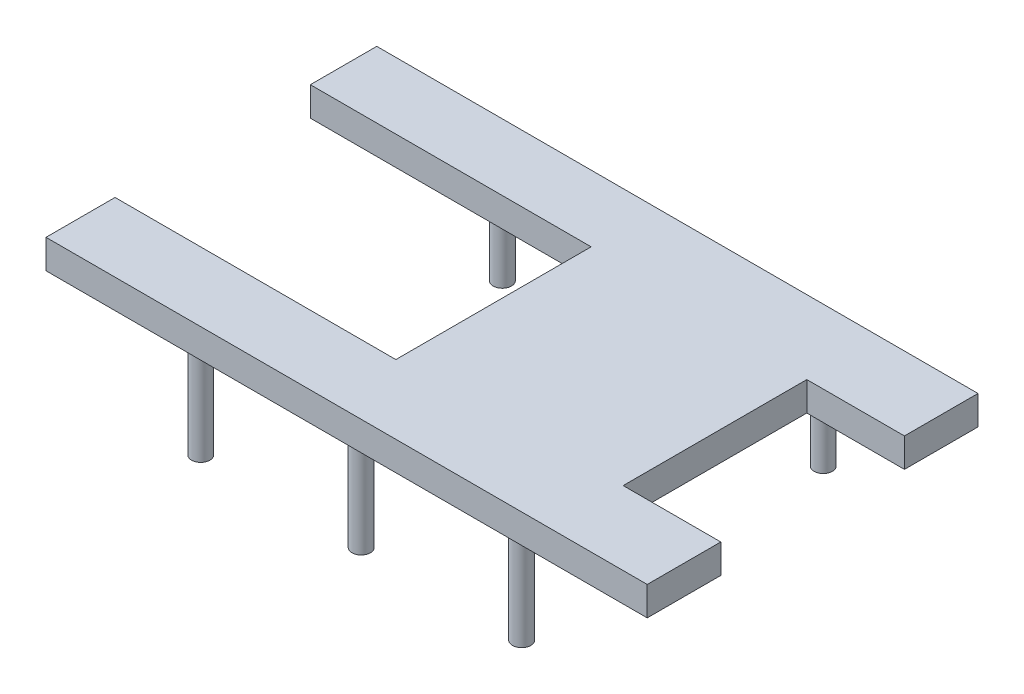
from build123d import *

# Parameters (mm, degrees)
SKETCH1_W           = 55.1
SKETCH1_H           = 27.8
BOSS_EXTRUDE1_DEPTH = 3
SKETCH3_W           = 21.65
SKETCH3_H           = 20.203759547
SKETCH3_W_2         = 17.65
SKETCH3_H_2         = 15.75
CUT_EXTRUDE1_DEPTH  = 32.00342723
SKETCH4_W           = 19.154601746
SKETCH4_H           = 20.203759547
CUT_EXTRUDE2_DEPTH  = 32.00342723
CUT_EXTRUDE3_DEPTH  = 10
SKETCH7_W           = 4.4
SKETCH7_H           = 3
BOSS_EXTRUDE2_DEPTH = 4.1
SKETCH8_W           = 3.662724417
SKETCH8_H           = 3
SKETCH8_W_2         = 3.933516036
BOSS_EXTRUDE3_DEPTH = 3
SKETCH9_W           = 62.2
SKETCH9_H           = 3
BOSS_EXTRUDE4_DEPTH = 3.21
SKETCH10_W          = 62.2
SKETCH10_H          = 3
BOSS_EXTRUDE5_DEPTH = 3.21
SKETCH11_R          = 0.95
BOSS_EXTRUDE6_DEPTH = 10


with BuildPart() as part:
    # Sketch1 → Boss-Extrude1 (new body)
    with BuildSketch(Plane(origin=(0, 0, 0), x_dir=(1, 0, 0), z_dir=(0, 1, 0))):
        Rectangle(SKETCH1_W, SKETCH1_H)
    extrude(amount=BOSS_EXTRUDE1_DEPTH)

    # Sketch3 → Cut-Extrude1 (cut, through all)
    # profile 1 of 2: a face of its own
    with BuildSketch(Plane.XZ):
        with Locations((-12.325, -0.13539581)):
            Rectangle(SKETCH3_W, SKETCH3_H)
        with Locations((-12.325, -0.375)):
            Rectangle(SKETCH3_W_2, SKETCH3_H_2, mode=Mode.SUBTRACT)
    # profile 2 of 2: a face of its own
    with BuildSketch(Plane.XZ):
        with Locations((-12.325, -0.375)):
            Rectangle(SKETCH3_W_2, SKETCH3_H_2)
    extrude(amount=-CUT_EXTRUDE1_DEPTH, mode=Mode.SUBTRACT)

    # Sketch4 → Cut-Extrude2 (cut, through all)
    with BuildSketch(Plane(origin=(0, 3, 0), x_dir=(1, 0, 0), z_dir=(0, 1, 0))):
        with Locations((-32.727300873, 0.13539581)):
            Rectangle(SKETCH4_W, SKETCH4_H)
    extrude(amount=-CUT_EXTRUDE2_DEPTH, mode=Mode.SUBTRACT)

    # Sketch5 → Cut-Extrude3 (cut)
    with BuildSketch(Plane(origin=(0, 3, 0), x_dir=(1, 0, 0), z_dir=(0, 1, 0))):
        Polygon((27.55, -9.5), (27.55, 0), (27.55, 9.5), (21.55, 9.5), (21.55, -9.5), align=None)
    extrude(amount=-CUT_EXTRUDE3_DEPTH, mode=Mode.SUBTRACT)

    # Sketch7 → Boss-Extrude2 (add)
    with BuildSketch(Plane(origin=(27.55, 0, 0), x_dir=(0, 0, -1), z_dir=(1, 0, 0))):
        with Locations((11.7, 1.5)):
            Rectangle(SKETCH7_W, SKETCH7_H)
        with Locations((-11.7, 1.5)):
            Rectangle(SKETCH7_W, SKETCH7_H)
    extrude(amount=BOSS_EXTRUDE2_DEPTH)

    # Sketch8 → Boss-Extrude3 (add)
    with BuildSketch(Plane.ZY.offset(27.55)):
        with Locations((-12.068637792, 1.5)):
            Rectangle(SKETCH8_W, SKETCH8_H)
        with Locations((11.933241982, 1.5)):
            Rectangle(SKETCH8_W_2, SKETCH8_H)
    extrude(amount=BOSS_EXTRUDE3_DEPTH)

    # Sketch9 → Boss-Extrude4 (add)
    with BuildSketch(Plane(origin=(0, 0, -13.9), x_dir=(-1, 0, 0), z_dir=(0, 0, -1))):
        with Locations((-0.55, 1.5)):
            Rectangle(SKETCH9_W, SKETCH9_H)
    extrude(amount=BOSS_EXTRUDE4_DEPTH)

    # Sketch10 → Boss-Extrude5 (add)
    with BuildSketch(Plane.XY.offset(13.9)):
        with Locations((0.55, 1.5)):
            Rectangle(SKETCH10_W, SKETCH10_H)
    extrude(amount=BOSS_EXTRUDE5_DEPTH)

    # Sketch11 → Boss-Extrude6 (add)
    with BuildSketch(Plane.XZ):
        with Locations(Location((-16.05, 15.6, 0), (0, 0, 90))):
            Circle(SKETCH11_R)
        with Locations(Location((-16.05, -15.6, 0), (0, 0, 90))):
            Circle(SKETCH11_R)
        with Locations(Location((0.55, -15.6, 0), (0, 0, 90))):
            Circle(SKETCH11_R)
        with Locations(Location((0.55, 15.6, 0), (0, 0, 90))):
            Circle(SKETCH11_R)
        with Locations(Location((17.15, 15.6, 0), (0, 0, 90))):
            Circle(SKETCH11_R)
        with Locations(Location((17.15, -15.6, 0), (0, 0, 90))):
            Circle(SKETCH11_R)
    extrude(amount=BOSS_EXTRUDE6_DEPTH)


solid = part.part
